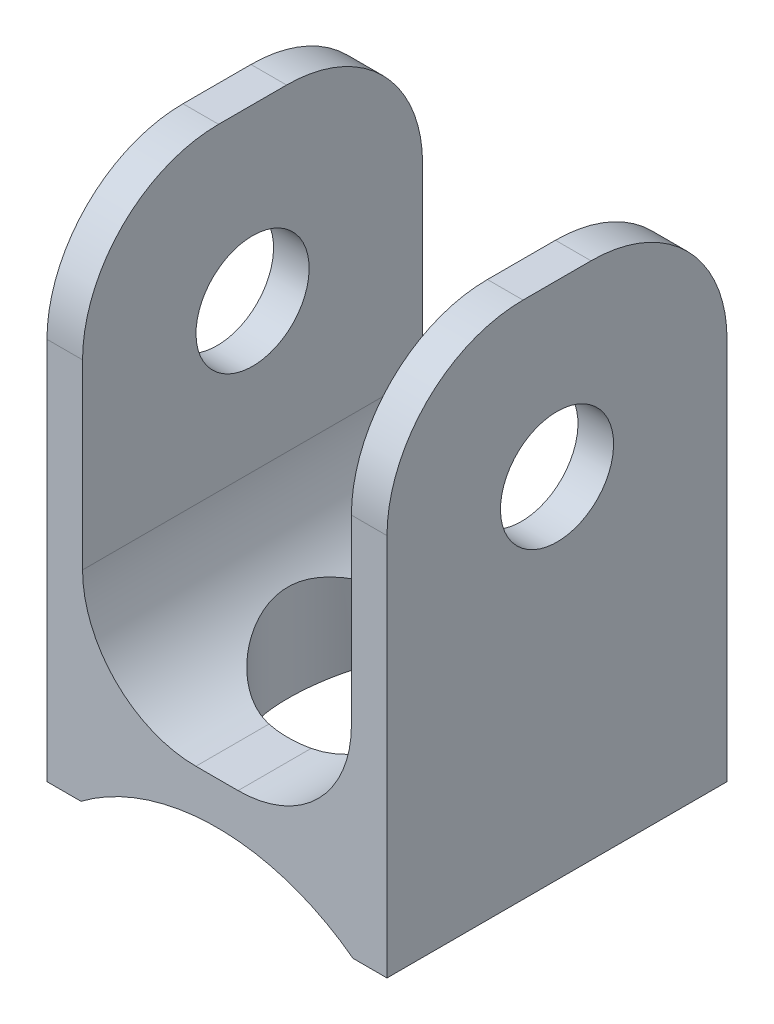
from build123d import *

# Parameters (mm, degrees)
BOSS_EXTRUDE1_DEPTH     = 9.525
SKETCH2_R               = 3.16865
CUT_EXTRUDE1_DEPTH      = 45.650209115
CUT_EXTRUDE2_DEPTH      = 42.490532643
CUT_EXTRUDE2_DEPTH_BACK = 42.490532643
SKETCH3_R               = 5.55625


with BuildPart() as part:
    # Sketch1 → Boss-Extrude1 (new, symmetric)
    with BuildSketch(Plane.XY):
        with BuildLine():
            Line((7.5311, 39.243), (9.525, 39.243))
            Line((9.525, 39.243), (9.525, 10.16))
            Line((9.525, 10.16), (7.62, 10.16))
            ThreePointArc((7.62, 10.16), (0, 12.7), (-7.62, 10.16))
            Line((-7.62, 10.16), (-9.525, 10.16))
            Line((-9.525, 10.16), (-9.525, 39.243))
            Line((-9.525, 39.243), (-7.5311, 39.243))
            Line((-7.5311, 39.243), (-7.5311, 21.43125))
            ThreePointArc((-7.5311, 21.43125), (-5.671228061, 16.941121939), (-1.1811, 15.08125))
            Line((-1.1811, 15.08125), (1.1811, 15.08125))
            ThreePointArc((1.1811, 15.08125), (5.671228061, 16.941121939), (7.5311, 21.43125))
            Line((7.5311, 21.43125), (7.5311, 39.243))
        make_face()
    extrude(amount=BOSS_EXTRUDE1_DEPTH, both=True)

    # Sketch2 → Cut-Extrude1 (cut, through all)
    with BuildSketch(Plane(origin=(9.525, 0, 0), x_dir=(0, 0, -1), z_dir=(1, 0, 0))):
        with Locations((0, 29.718)):
            Circle(SKETCH2_R)
        with BuildLine():
            Line((-9.525, 31.623), (-9.525, 39.243))
            Line((-9.525, 39.243), (-1.905, 39.243))
            ThreePointArc((-1.905, 39.243), (-7.293153673, 37.011153673), (-9.525, 31.623))
        make_face()
        with BuildLine():
            Line((9.525, 31.623), (9.525, 39.243))
            Line((9.525, 39.243), (1.905, 39.243))
            ThreePointArc((1.905, 39.243), (7.293153673, 37.011153673), (9.525, 31.623))
        make_face()
    extrude(amount=-CUT_EXTRUDE1_DEPTH, mode=Mode.SUBTRACT)

    # Sketch3 → Cut-Extrude2 (cut, two sides: drawn at the far end of the back side and taken through both)
    with BuildSketch(Plane(origin=(0, 0, 0), x_dir=(1, 0, 0), z_dir=(0, 1, 0)).offset(-CUT_EXTRUDE2_DEPTH_BACK)):
        Circle(SKETCH3_R)
    extrude(amount=CUT_EXTRUDE2_DEPTH + CUT_EXTRUDE2_DEPTH_BACK, mode=Mode.SUBTRACT)


solid = part.part
